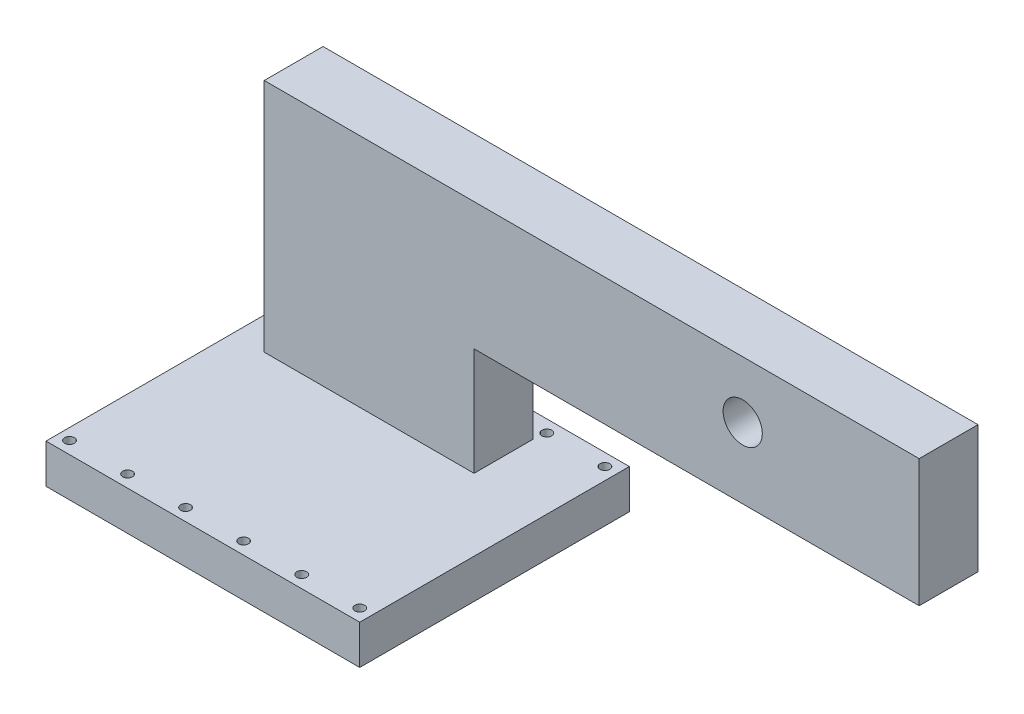
from build123d import *

# Parameters (mm, degrees)
BOSS_EXTRUDE1_DEPTH = 19.05
SKETCH2_R           = 12.7
CUT_EXTRUDE1_DEPTH  = 453.333994301
SKETCH4_W           = 203.2
SKETCH4_H           = 174.625
SKETCH4_R           = 3.175
BOSS_EXTRUDE2_DEPTH = 25.4


with BuildPart() as part:
    # Sketch1 → Boss-Extrude1 (new, symmetric)
    with BuildSketch(Plane.XY):
        Polygon((0, 0), (0, 152.4), (424.18, 152.4), (424.18, 69.85), (135.89, 69.85), (135.89, 0), align=None)
    extrude(amount=BOSS_EXTRUDE1_DEPTH, both=True)

    # Sketch2 → Cut-Extrude1 (cut, through all)
    with BuildSketch(Plane.XY.offset(19.05)):
        with Locations((309.88, 115.57)):
            Circle(SKETCH2_R)
    extrude(amount=-CUT_EXTRUDE1_DEPTH, mode=Mode.SUBTRACT)


with BuildPart() as body_2:
    # Sketch4 → Boss-Extrude2 (new body)
    with BuildSketch(Plane.XZ):
        with Locations((80.772, 52.2605)):
            Rectangle(SKETCH4_W, SKETCH4_H)
        with Locations((174.4345, 131.6355)):
            Circle(SKETCH4_R, mode=Mode.SUBTRACT)
        with Locations((136.8425, 131.6355)):
            Circle(SKETCH4_R, mode=Mode.SUBTRACT)
        with Locations((99.2505, 131.6355)):
            Circle(SKETCH4_R, mode=Mode.SUBTRACT)
        with Locations((61.6585, 131.6355)):
            Circle(SKETCH4_R, mode=Mode.SUBTRACT)
        with Locations((24.0665, 131.6355)):
            Circle(SKETCH4_R, mode=Mode.SUBTRACT)
        with Locations((-13.5255, 131.6355)):
            Circle(SKETCH4_R, mode=Mode.SUBTRACT)
        with Locations((174.4345, -27.1145)):
            Circle(SKETCH4_R, mode=Mode.SUBTRACT)
        with Locations((136.8425, -27.1145)):
            Circle(SKETCH4_R, mode=Mode.SUBTRACT)
        with Locations((99.2505, -27.1145)):
            Circle(SKETCH4_R, mode=Mode.SUBTRACT)
        with Locations((61.6585, -27.1145)):
            Circle(SKETCH4_R, mode=Mode.SUBTRACT)
        with Locations((24.0665, -27.1145)):
            Circle(SKETCH4_R, mode=Mode.SUBTRACT)
        with Locations((-13.5255, -27.1145)):
            Circle(SKETCH4_R, mode=Mode.SUBTRACT)
    extrude(amount=BOSS_EXTRUDE2_DEPTH)


solid = Compound([part.part, body_2.part])
